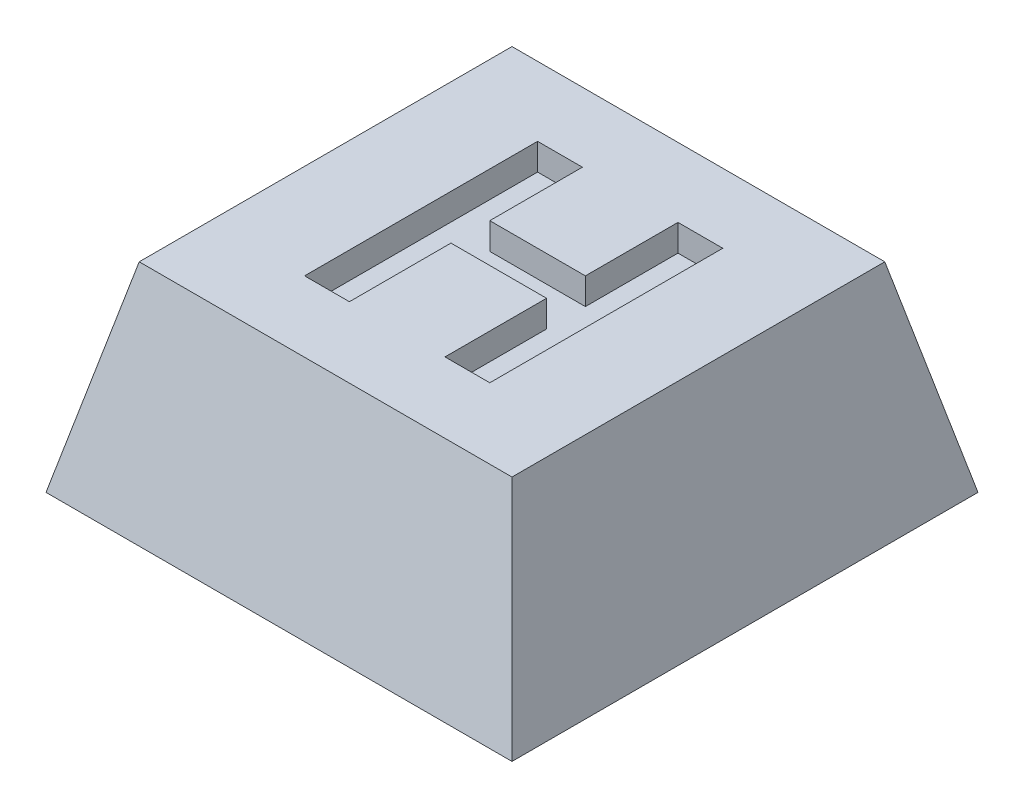
from build123d import *

# Parameters (mm, degrees)
SKETCH1_W           = 7
SKETCH1_H           = 7
BOSS_EXTRUDE1_DEPTH = 3
CUT_EXTRUDE1_DEPTH  = 7
CUT_EXTRUDE2_DEPTH  = 11
SKETCH4_R           = 1.8
CUT_EXTRUDE3_DEPTH  = 0.8
CUT_EXTRUDE4_DEPTH  = 0.4


with BuildPart() as part:
    # Sketch1 → Boss-Extrude1 (new body)
    with BuildSketch(Plane(origin=(0, 0, 0), x_dir=(1, 0, 0), z_dir=(0, 1, 0))):
        with Locations((3.5, 3.5)):
            Rectangle(SKETCH1_W, SKETCH1_H)
    extrude(amount=BOSS_EXTRUDE1_DEPTH)

    # Sketch2 → Cut-Extrude1 (cut)
    with BuildSketch(Plane.XY):
        Polygon((0, 0), (0.7, 3), (0, 3), align=None)
        Polygon((7, 0), (6.3, 3), (7, 3), align=None)
    extrude(amount=-CUT_EXTRUDE1_DEPTH, mode=Mode.SUBTRACT)

    # Sketch3 → Cut-Extrude2 (cut)
    with BuildSketch(Plane(origin=(0, 0, 0), x_dir=(0, 0, -1), z_dir=(1, 0, 0))):
        Polygon((0, 0), (0.7, 3), (0, 3), align=None)
        Polygon((7, 3), (6.3, 3), (7, 0), align=None)
    extrude(amount=CUT_EXTRUDE2_DEPTH, mode=Mode.SUBTRACT)

    # Sketch4 → Cut-Extrude3 (cut)
    with BuildSketch(Plane.XZ):
        with Locations(Location((3.5, -3.5, 0), (0, 0, 270))):
            Circle(SKETCH4_R)
    extrude(amount=-CUT_EXTRUDE3_DEPTH, mode=Mode.SUBTRACT)

    # Sketch6 → Cut-Extrude4 (cut)
    with BuildSketch(Plane(origin=(0, 3, 0), x_dir=(1, 0, 0), z_dir=(0, 1, 0))):
        Polygon((2.125003678, 1.759282352), (2.125003678, 5.259282352), (2.798080601, 5.259282352), (2.798080601, 3.868256711), (4.233978037, 3.868256711), (4.233978037, 5.259282352), (4.90705496, 5.259282352), (4.90705496, 1.759282352), (4.233978037, 1.759282352), (4.233978037, 3.284923377), (2.798080601, 3.284923377), (2.798080601, 1.759282352), align=None)
    extrude(amount=-CUT_EXTRUDE4_DEPTH, mode=Mode.SUBTRACT)


solid = part.part
